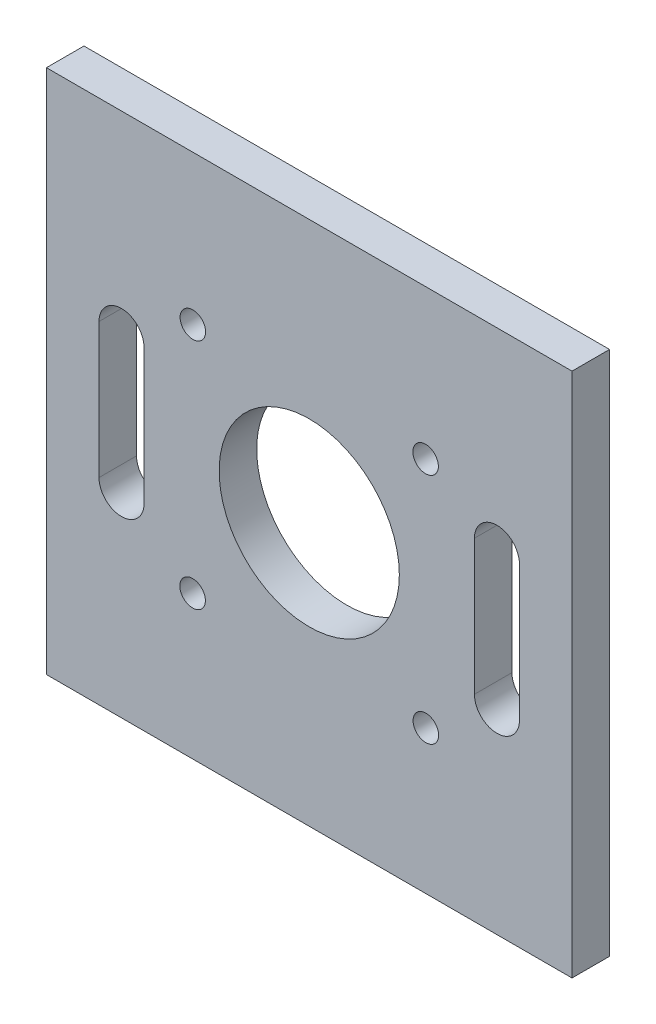
from build123d import *

# Parameters (mm, degrees)
SKETCH1_W           = 70
SKETCH1_H           = 70
BOSS_EXTRUDE1_DEPTH = 5
SKETCH2_R           = 12
SKETCH2_R_2         = 1.7
CUT_EXTRUDE6_DEPTH  = 50.749371855
CUT_EXTRUDE7_DEPTH  = 50.749371855


with BuildPart() as part:
    # Sketch1 → Boss-Extrude1 (new body)
    with BuildSketch(Plane.XY):
        Rectangle(SKETCH1_W, SKETCH1_H)
    extrude(amount=BOSS_EXTRUDE1_DEPTH)

    # Sketch2 → Cut-Extrude6 (cut, through all)
    with BuildSketch(Plane.XY.offset(5)):
        Circle(SKETCH2_R)
        with Locations((15.5, 15.112797807)):
            Circle(SKETCH2_R_2)
        with Locations((15.532292635, -15.887185373)):
            Circle(SKETCH2_R_2)
        with Locations(Location((-15.532292635, -15.887185373, 0), (0, 0, 180))):
            Circle(SKETCH2_R_2)
        with Locations(Location((-15.5, 15.112797807, 0), (0, 0, 180))):
            Circle(SKETCH2_R_2)
    extrude(amount=-CUT_EXTRUDE6_DEPTH, mode=Mode.SUBTRACT)

    # Sketch3 → Cut-Extrude7 (cut, through all)
    with BuildSketch(Plane.XY.offset(5)):
        with BuildLine():
            Line((-22, 9.22322481), (-22, -8.77677519))
            ThreePointArc((-22, -8.77677519), (-25, -11.77677519), (-28, -8.77677519))
            Line((-28, -8.77677519), (-28, 9.22322481))
            ThreePointArc((-28, 9.22322481), (-25, 12.22322481), (-22, 9.22322481))
        make_face()
        with BuildLine():
            Line((22, 9.22322481), (22, -8.77677519))
            ThreePointArc((22, -8.77677519), (25, -11.77677519), (28, -8.77677519))
            Line((28, -8.77677519), (28, 9.22322481))
            ThreePointArc((28, 9.22322481), (25, 12.22322481), (22, 9.22322481))
        make_face()
    extrude(amount=-CUT_EXTRUDE7_DEPTH, mode=Mode.SUBTRACT)


solid = part.part
